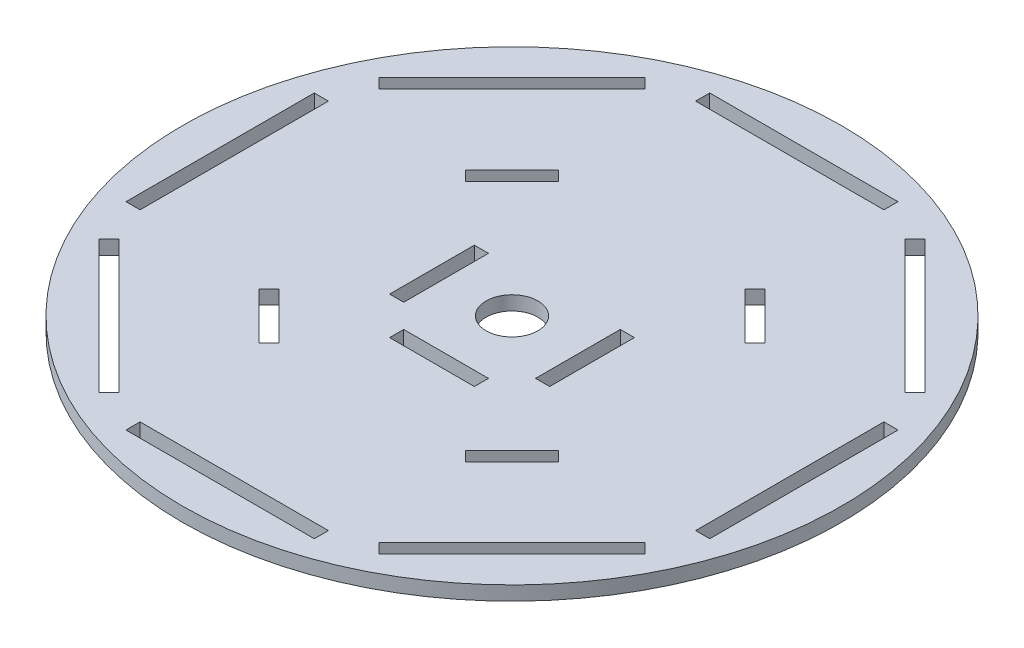
from build123d import *

# Parameters (mm, degrees)
CROQUIS1_R              = 70
CROQUIS1_R_2            = 5.5
SALIENTE_EXTRUIR1_DEPTH = 3


with BuildPart() as part:
    # Croquis1 → Saliente-Extruir1 (new body)
    with BuildSketch(Plane(origin=(0, 0, 0), x_dir=(1, 0, 0), z_dir=(0, 1, 0))):
        with Locations(Location((0, 0, 0), (0, 0, 270))):
            Circle(CROQUIS1_R)
        with Locations(Location((0, 0, 0), (0, 0, 270))):
            Circle(CROQUIS1_R_2, mode=Mode.SUBTRACT)
        Polygon((24.748737342, 24.748737342), (29.69848481, 19.798989873), (31.819805153, 21.920310217), (21.920310217, 31.819805153), (19.798989873, 29.69848481), align=None, mode=Mode.SUBTRACT)
        Polygon((24.748737342, -24.748737342), (19.798989873, -29.69848481), (21.920310217, -31.819805153), (31.819805153, -21.920310217), (29.69848481, -19.798989873), align=None, mode=Mode.SUBTRACT)
        Polygon((-24.748737342, 24.748737342), (-19.798989873, 29.69848481), (-21.920310217, 31.819805153), (-31.819805153, 21.920310217), (-29.69848481, 19.798989873), align=None, mode=Mode.SUBTRACT)
        Polygon((-24.748737342, -24.748737342), (-29.69848481, -19.798989873), (-31.819805153, -21.920310217), (-21.920310217, -31.819805153), (-19.798989873, -29.69848481), align=None, mode=Mode.SUBTRACT)
        Polygon((-14, 0), (-14, 9), (-17, 9), (-17, -9), (-14, -9), align=None, mode=Mode.SUBTRACT)
        Polygon((14, 0), (14, -9), (17, -9), (17, 9), (14, 9), align=None, mode=Mode.SUBTRACT)
        Polygon((0, -14), (-9, -14), (-9, -17), (9, -17), (9, -14), align=None, mode=Mode.SUBTRACT)
        Polygon((0, 62), (20, 62), (20, 59), (-20, 59), (-20, 62), align=None, mode=Mode.SUBTRACT)
        Polygon((55.861435714, 27.577164466), (27.577164466, 55.861435714), (29.69848481, 57.982756057), (43.840620434, 43.840620434), (57.982756057, 29.69848481), align=None, mode=Mode.SUBTRACT)
        Polygon((59, -20), (59, 20), (62, 20), (62, 0), (62, -20), align=None, mode=Mode.SUBTRACT)
        Polygon((27.577164466, -55.861435714), (55.861435714, -27.577164466), (57.982756057, -29.69848481), (43.840620434, -43.840620434), (29.69848481, -57.982756057), align=None, mode=Mode.SUBTRACT)
        Polygon((-20, -59), (20, -59), (20, -62), (0, -62), (-20, -62), align=None, mode=Mode.SUBTRACT)
        Polygon((-55.861435714, -27.577164466), (-27.577164466, -55.861435714), (-29.69848481, -57.982756057), (-43.840620434, -43.840620434), (-57.982756057, -29.69848481), align=None, mode=Mode.SUBTRACT)
        Polygon((-59, 20), (-59, -20), (-62, -20), (-62, 0), (-62, 20), align=None, mode=Mode.SUBTRACT)
        Polygon((-27.577164466, 55.861435714), (-55.861435714, 27.577164466), (-57.982756057, 29.69848481), (-43.840620434, 43.840620434), (-29.69848481, 57.982756057), align=None, mode=Mode.SUBTRACT)
    extrude(amount=SALIENTE_EXTRUIR1_DEPTH)


solid = part.part
